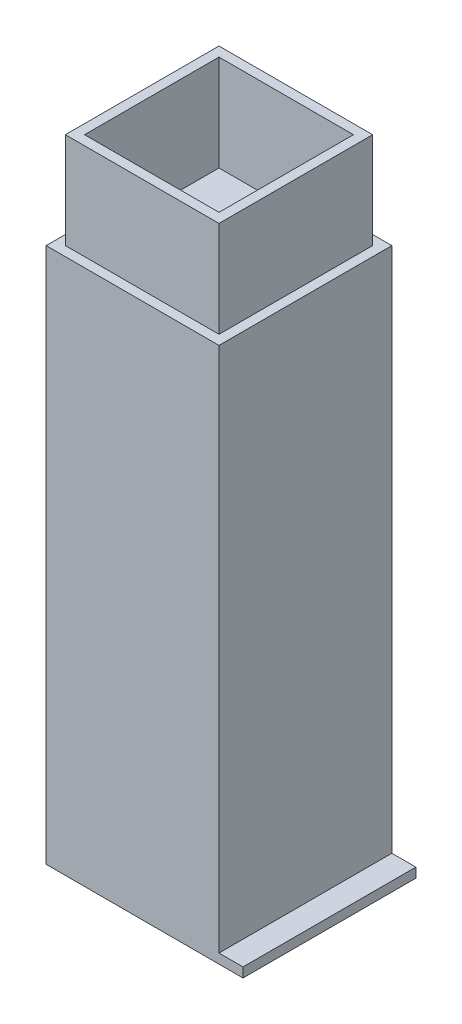
from build123d import *

# Parameters (mm, degrees)
SKETCH1_W           = 36
SKETCH1_H           = 36
SKETCH1_W_2         = 32
SKETCH1_H_2         = 32
BOSS_EXTRUDE1_DEPTH = 76.2
SKETCH2_W           = 36
SKETCH2_H           = 36
BOSS_EXTRUDE2_DEPTH = 5
SKETCH3_W           = 36
SKETCH3_H           = 36
SKETCH3_W_2         = 32
SKETCH3_H_2         = 32
BOSS_EXTRUDE3_DEPTH = 25.4
SKETCH4_W           = 36
SKETCH4_H           = 2
BOSS_EXTRUDE4_DEPTH = 5
SKETCH5_W           = 36
SKETCH5_H           = 36
BOSS_EXTRUDE5_DEPTH = 5
SKETCH6_W           = 32
SKETCH6_H           = 32
SKETCH6_W_2         = 28
SKETCH6_H_2         = 28
BOSS_EXTRUDE6_DEPTH = 20


with BuildPart() as part:
    # Sketch1 → Boss-Extrude1 (new body)
    with BuildSketch(Plane(origin=(0, 0, 0), x_dir=(1, 0, 0), z_dir=(0, 1, 0))):
        with Locations((-61.04447382, 32.009277239)):
            Rectangle(SKETCH1_W, SKETCH1_H)
        with Locations((-61.04447382, 32.009277239)):
            Rectangle(SKETCH1_W_2, SKETCH1_H_2, mode=Mode.SUBTRACT)
    extrude(amount=BOSS_EXTRUDE1_DEPTH)

    # Sketch2 → Boss-Extrude2 (add)
    with BuildSketch(Plane.XZ):
        with Locations((-61.04447382, -32.009277239)):
            Rectangle(SKETCH2_W, SKETCH2_H)
    extrude(amount=BOSS_EXTRUDE2_DEPTH)

    # Sketch3 → Boss-Extrude3 (add)
    with BuildSketch(Plane.XZ.offset(5)):
        with Locations((-61.04447382, -32.009277239)):
            Rectangle(SKETCH3_W, SKETCH3_H)
        with Locations((-61.04447382, -32.009277239)):
            Rectangle(SKETCH3_W_2, SKETCH3_H_2, mode=Mode.SUBTRACT)
    extrude(amount=BOSS_EXTRUDE3_DEPTH)

    # Sketch4 → Boss-Extrude4 (add)
    with BuildSketch(Plane(origin=(-43.04447382, 0, 0), x_dir=(0, 0, -1), z_dir=(1, 0, 0))):
        with Locations((32.009277239, -29.4)):
            Rectangle(SKETCH4_W, SKETCH4_H)
    extrude(amount=BOSS_EXTRUDE4_DEPTH)

    # Sketch5 → Boss-Extrude5 (add)
    with BuildSketch(Plane(origin=(0, 76.2, 0), x_dir=(1, 0, 0), z_dir=(0, 1, 0))):
        with Locations((-61.04447382, 32.009277239)):
            Rectangle(SKETCH5_W, SKETCH5_H)
    extrude(amount=BOSS_EXTRUDE5_DEPTH)

    # Sketch6 → Boss-Extrude6 (add)
    with BuildSketch(Plane(origin=(0, 81.2, 0), x_dir=(1, 0, 0), z_dir=(0, 1, 0))):
        with Locations((-61.04447382, 32.009277239)):
            Rectangle(SKETCH6_W, SKETCH6_H)
        with Locations((-61.04447382, 32.009277239)):
            Rectangle(SKETCH6_W_2, SKETCH6_H_2, mode=Mode.SUBTRACT)
    extrude(amount=BOSS_EXTRUDE6_DEPTH)


solid = part.part
